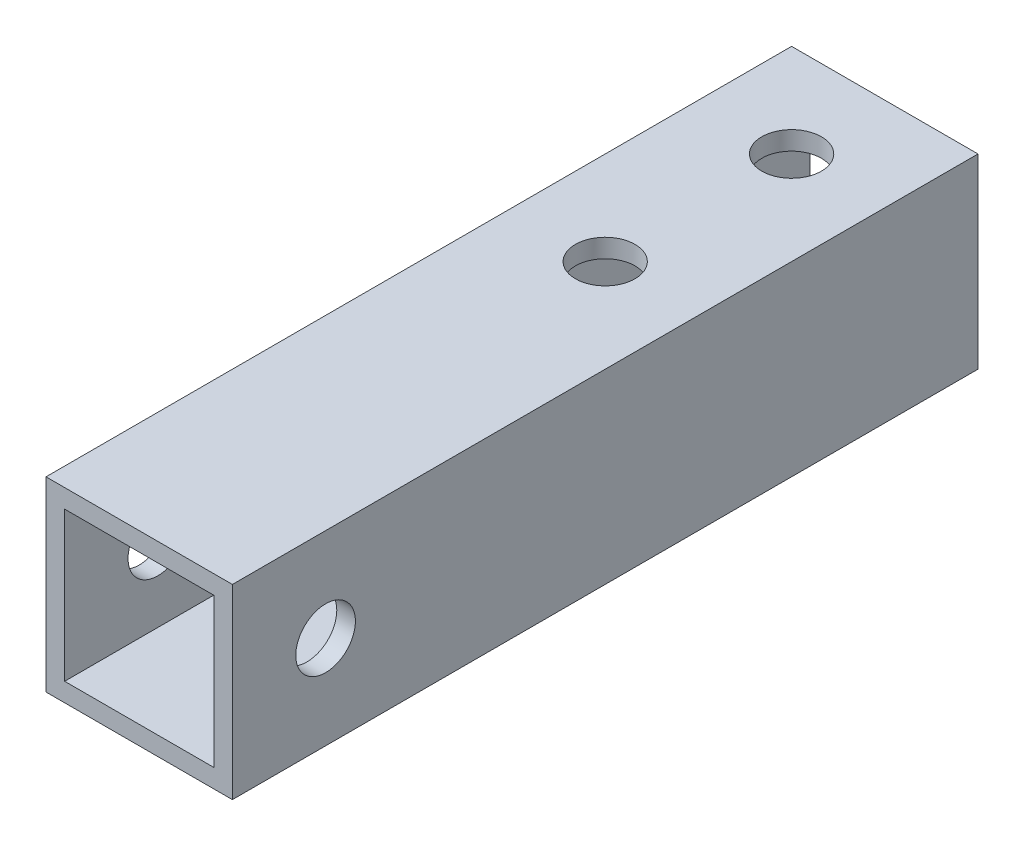
from build123d import *

# Parameters (mm, degrees)
SKETCH_283_W          = 10
SKETCH_283_H          = 10
SKETCH_283_W_2        = 8
SKETCH_283_H_2        = 8
EXTRUDE_340_DEPTH     = 40
SKETCH_412_R          = 1.6
CUT_EXTRUDE_784_DEPTH = 42.533119315
SKETCH_624_R          = 1.6
CUT_EXTRUDE_828_DEPTH = 42.533119315


with BuildPart() as part:
    # Sketch 283 → Extrude 340 (new body)
    with BuildSketch(Plane.XY):
        Rectangle(SKETCH_283_W, SKETCH_283_H)
        Rectangle(SKETCH_283_W_2, SKETCH_283_H_2, mode=Mode.SUBTRACT)
    extrude(amount=EXTRUDE_340_DEPTH)

    # Sketch 412 → Cut-Extrude 784 (cut, through all)
    with BuildSketch(Plane(origin=(0, 5, 0), x_dir=(1, 0, 0), z_dir=(0, 1, 0))):
        with Locations(Location((0, -5, 0), (0, 0, 270))):
            Circle(SKETCH_412_R)
        with Locations(Location((0, -15, 0), (0, 0, 270))):
            Circle(SKETCH_412_R)
    extrude(amount=-CUT_EXTRUDE_784_DEPTH, mode=Mode.SUBTRACT)

    # Sketch 624 → Cut-Extrude 828 (cut, through all)
    with BuildSketch(Plane(origin=(5, 0, 0), x_dir=(0, 0, -1), z_dir=(1, 0, 0))):
        with Locations((-35, 0)):
            Circle(SKETCH_624_R)
    extrude(amount=-CUT_EXTRUDE_828_DEPTH, mode=Mode.SUBTRACT)


solid = part.part
